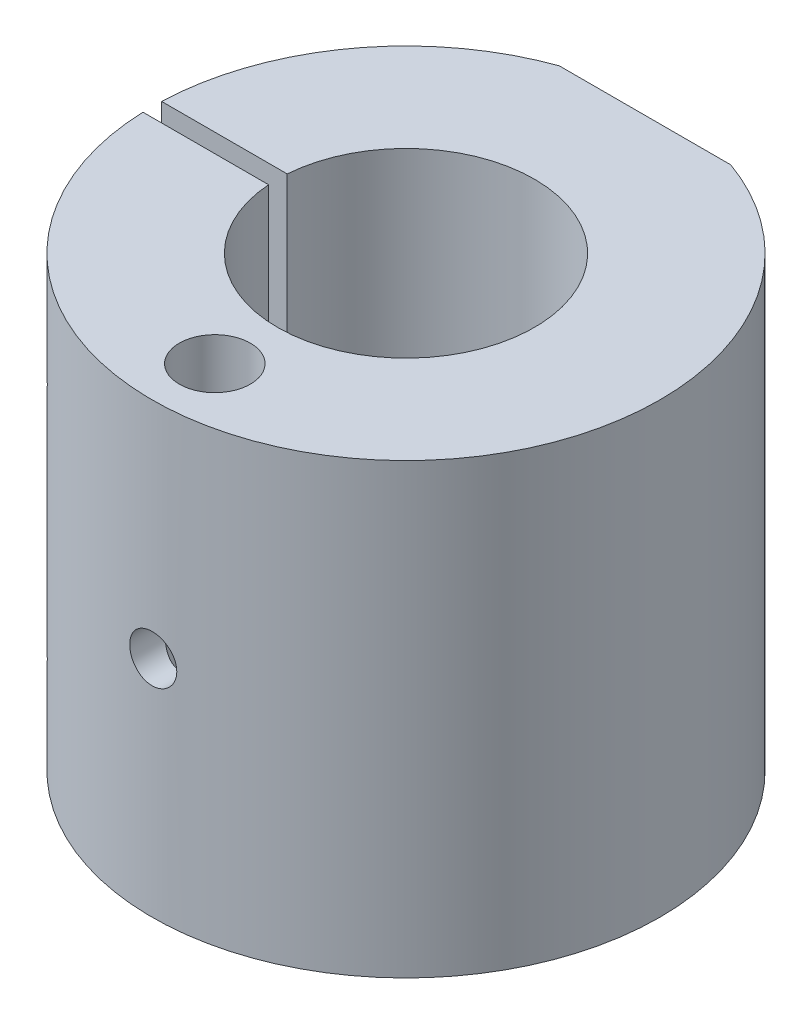
from build123d import *

# Parameters (mm, degrees)
SKETCH2_R                        = 21.59
SKETCH2_R_2                      = 10.922
BOSS_EXTRUDE1_DEPTH              = 38.1
CUT_EXTRUDE1_REACH               = 50.825
SKETCH3_W                        = 21.59
SKETCH3_H                        = 1.5875
CUT_EXTRUDE2_REACH               = 50.825
SKETCH4_R                        = 3.0226
CUT_EXTRUDE3_REACH               = 50.825
TAP_DRILL_FOR_M3X0_5_TAP1_D      = 2.5
TAP_DRILL_FOR_M3X0_5_TAP1_DEPTH  = 4.572
TAP_DRILL_FOR_M3X0_5_TAP1_TIP    = 0.751075774
CUT_EXTRUDE4_REACH               = 62.615
CUT_EXTRUDE4_END_RADIUS          = 3.0226
SKETCH8_R                        = 2.000000064
TAP_DRILL_FOR_M4X0_7_TAP1_REACH  = 54.19
TAP_DRILL_FOR_M4X0_7_TAP1_BORE_R = 1.65


with BuildPart() as part:
    # Sketch2 → Boss-Extrude1 (new body)
    with BuildSketch(Plane(origin=(0, 0, 0), x_dir=(1, 0, 0), z_dir=(0, 1, 0))):
        with Locations(Location((0, 0, 0), (0, 0, 90))):
            Circle(SKETCH2_R)
        with Locations(Location((0, 0, 0), (0, 0, 90))):
            Circle(SKETCH2_R_2, mode=Mode.SUBTRACT)
    extrude(amount=BOSS_EXTRUDE1_DEPTH)

    # Sketch3 → Cut-Extrude1 (cut, up to next)
    with BuildSketch(Plane(origin=(0, 38.1, 0), x_dir=(1, 0, 0), z_dir=(0, 1, 0)), mode=Mode.PRIVATE) as cut_extrude1_sk1:
        with Locations((-10.795, 0)):
            Rectangle(SKETCH3_W, SKETCH3_H)
    cut_extrude1_tool1 = extrude(cut_extrude1_sk1.sketch, amount=-CUT_EXTRUDE1_REACH, mode=Mode.PRIVATE) & part.part
    add(cut_extrude1_tool1.solids().sort_by_distance((-10.795, 38.1, 0))[0], mode=Mode.SUBTRACT)

    # Sketch4 → Cut-Extrude2 (cut, up to next)
    with BuildSketch(Plane(origin=(0, 38.1, 0), x_dir=(1, 0, 0), z_dir=(0, 1, 0)), mode=Mode.PRIVATE) as cut_extrude2_sk1:
        with Locations(Location((0, -16.256, 0), (0, 0, 270))):
            Circle(SKETCH4_R)
    cut_extrude2_tool1 = extrude(cut_extrude2_sk1.sketch, amount=-CUT_EXTRUDE2_REACH, mode=Mode.PRIVATE) & part.part
    add(cut_extrude2_tool1.solids().sort_by_distance((0, 38.1, 16.256))[0], mode=Mode.SUBTRACT)

    # Sketch5 → Cut-Extrude3 (cut, up to next)
    with BuildSketch(Plane(origin=(0, 38.1, 0), x_dir=(1, 0, 0), z_dir=(0, 1, 0)), mode=Mode.PRIVATE) as cut_extrude3_sk1:
        with BuildLine():
            Line((7.295594561, 20.32), (-7.295594561, 20.32))
            ThreePointArc((-7.295594561, 20.32), (0, 21.59), (7.295594561, 20.32))
        make_face()
    cut_extrude3_tool1 = extrude(cut_extrude3_sk1.sketch, amount=-CUT_EXTRUDE3_REACH, mode=Mode.PRIVATE) & part.part
    add(cut_extrude3_tool1.solids().sort_by_distance((0, 38.1, -20.829303))[0], mode=Mode.SUBTRACT)

    # Tap Drill for M3x0.5 Tap1
    with Locations(Plane(origin=(0, 19.05, -20.32), x_dir=(-1, 0, 0), z_dir=(0, 0, -1))):
        with Locations((0, 0)):
            Hole(TAP_DRILL_FOR_M3X0_5_TAP1_D / 2, depth=TAP_DRILL_FOR_M3X0_5_TAP1_DEPTH)
            with Locations((0, 0, -(TAP_DRILL_FOR_M3X0_5_TAP1_DEPTH + TAP_DRILL_FOR_M3X0_5_TAP1_TIP / 2))):  # 118° drill point
                Cone(0, TAP_DRILL_FOR_M3X0_5_TAP1_D / 2, TAP_DRILL_FOR_M3X0_5_TAP1_TIP, mode=Mode.SUBTRACT)

    # Cut-Extrude4: up to this cylinder (the profile starts outside it)
    cut_extrude4_end = Plane(origin=(0, 19.05, 16.256), z_dir=(0, 1, 0)) * Cylinder(CUT_EXTRUDE4_END_RADIUS, 132.2752, mode=Mode.PRIVATE)
    # Sketch8 → Cut-Extrude4 (cut, up to the surface)
    with BuildSketch(Plane.XY.offset(21.59), mode=Mode.PRIVATE) as cut_extrude4_sk1:
        with Locations((0.007297963, 19.05)):
            Circle(SKETCH8_R)
    cut_extrude4_tool1 = extrude(cut_extrude4_sk1.sketch, amount=-CUT_EXTRUDE4_REACH, mode=Mode.PRIVATE) - cut_extrude4_end
    add(cut_extrude4_tool1.solids().sort_by_distance((0.007298, 19.05, 21.59))[0], mode=Mode.SUBTRACT)

    # Tap Drill for M4x0.7 Tap1 bore (on position points) → Tap Drill for M4x0.7 Tap1 (cut, up to next)
    with BuildSketch(Plane(origin=(-16.234261615, 29.109235595, 0.79375), x_dir=(-1, 0, 0), z_dir=(0, 0, -1)), mode=Mode.PRIVATE) as tap_drill_for_m4x0_7_tap1_sk1:
        Circle(TAP_DRILL_FOR_M4X0_7_TAP1_BORE_R)
    tap_drill_for_m4x0_7_tap1_tool1 = extrude(tap_drill_for_m4x0_7_tap1_sk1.sketch, amount=-TAP_DRILL_FOR_M4X0_7_TAP1_REACH, mode=Mode.PRIVATE) & part.part
    # Tap Drill for M4x0.7 Tap1 bore (on position points) → Tap Drill for M4x0.7 Tap1 (cut, up to next)
    with BuildSketch(Plane(origin=(-16.234261615, 29.109235595, 0.79375), x_dir=(-1, 0, 0), z_dir=(0, 0, -1)), mode=Mode.PRIVATE) as tap_drill_for_m4x0_7_tap1_sk2:
        with Locations((0, -20.205281104)):
            Circle(TAP_DRILL_FOR_M4X0_7_TAP1_BORE_R)
    tap_drill_for_m4x0_7_tap1_tool2 = extrude(tap_drill_for_m4x0_7_tap1_sk2.sketch, amount=-TAP_DRILL_FOR_M4X0_7_TAP1_REACH, mode=Mode.PRIVATE) & part.part
    add(tap_drill_for_m4x0_7_tap1_tool1.solids().sort_by_distance((-16.234262, 29.109236, 0.79375))[0], mode=Mode.SUBTRACT)
    add(tap_drill_for_m4x0_7_tap1_tool2.solids().sort_by_distance((-16.234262, 8.903954, 0.79375))[0], mode=Mode.SUBTRACT)


solid = part.part
